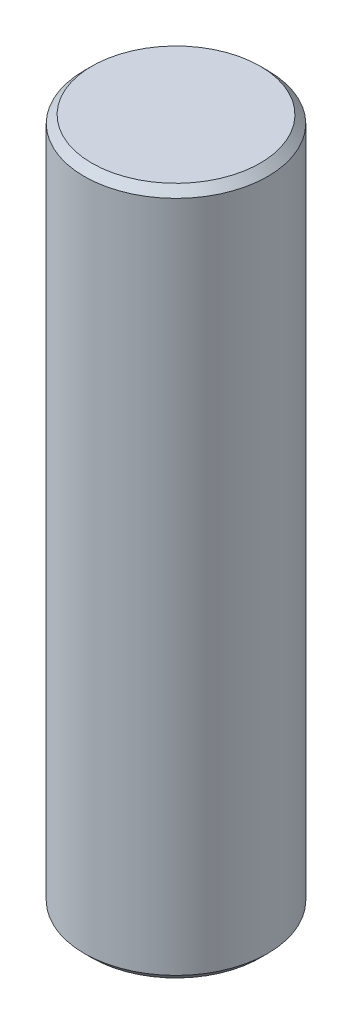
from build123d import *

# Parameters (mm, degrees)
SKETCH1_W     = 6
SKETCH1_H     = 45
CHAMFER1_SIZE = 0.5


with BuildPart() as part:
    # Sketch1 → Revolve1 (revolve)
    with BuildSketch(Plane.XY, mode=Mode.PRIVATE) as revolve1_sk:
        with Locations((-3, 22.5)):
            Rectangle(SKETCH1_W, SKETCH1_H)
    revolve(revolve1_sk.sketch.rotate(Axis((0, 0, 0), (0, 1, 0)), 270), axis=Axis((0, 0, 0), (0, 1, 0)))

    # Chamfer1
    chamfer1_edges = [part.edges().sort_by_distance(p)[0] for p in [
        (0, 0, 6),
        (0, 45, 6),
    ]]
    chamfer(chamfer1_edges, length=CHAMFER1_SIZE)


solid = part.part
